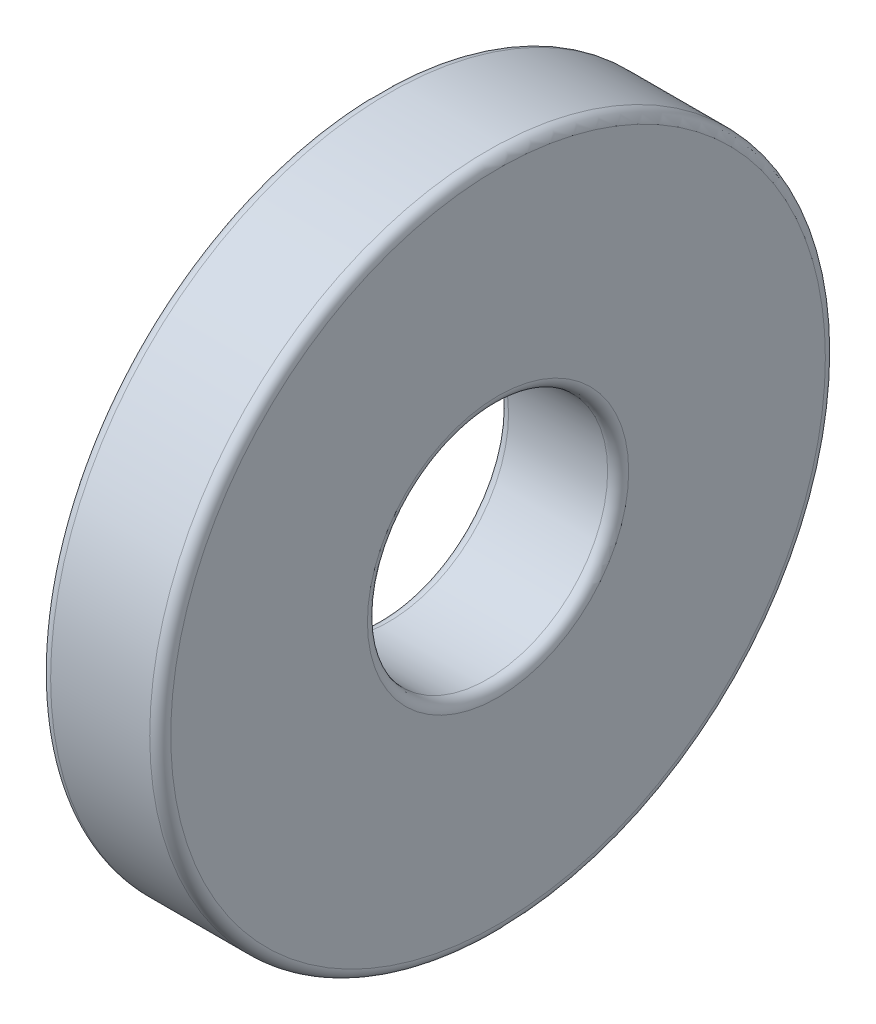
from build123d import *

# Parameters (mm, degrees)
SKETCH1_R           = 11.25
SKETCH1_R_2         = 4
BOSS_EXTRUDE1_DEPTH = 4
FILLET2_R           = 0.35


with BuildPart() as part:
    # Sketch1 → Boss-Extrude1 (new body)
    with BuildSketch(Plane(origin=(0, 0, 0), x_dir=(0, 0, -1), z_dir=(1, 0, 0))):
        Circle(SKETCH1_R)
        Circle(SKETCH1_R_2, mode=Mode.SUBTRACT)
    extrude(amount=BOSS_EXTRUDE1_DEPTH)

    # Fillet2
    fillet2_edges = [part.edges().sort_by_distance(p)[0] for p in [
        (0, 0, 11.25),
        (4, 0, 11.25),
        (0, 0, 4),
        (4, 0, 4),
    ]]
    fillet(fillet2_edges, radius=FILLET2_R)


solid = part.part
